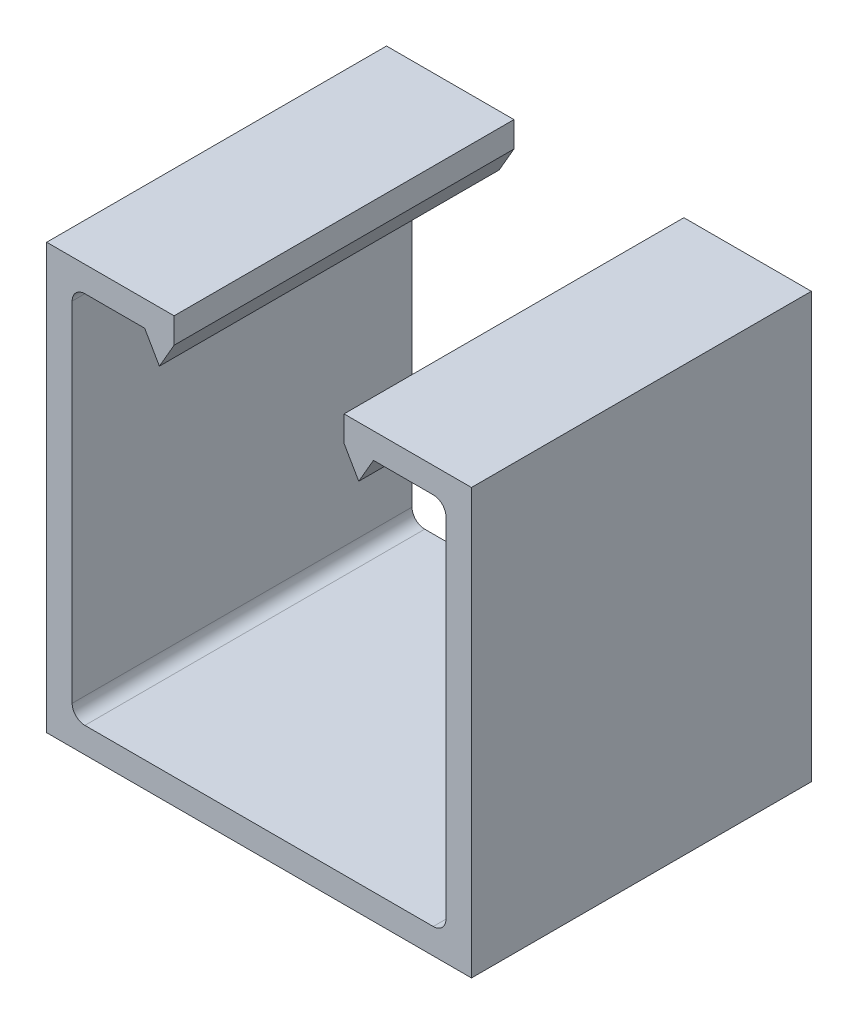
from build123d import *

# Parameters (mm, degrees)
BASE_EXTRUDE_DEPTH = 12.7


with BuildPart() as part:
    # Sketch1 → Base-Extrude (new, symmetric)
    with BuildSketch(Plane.XY):
        with BuildLine():
            Line((-6.35, 15.875), (-15.875, 15.875))
            Line((-15.875, 15.875), (-15.875, -15.875))
            Line((-15.875, -15.875), (15.875, -15.875))
            Line((15.875, -15.875), (15.875, 15.875))
            Line((15.875, 15.875), (6.35, 15.875))
            Line((6.35, 15.875), (6.35, 13.97))
            Line((6.35, 13.97), (7.449852264, 12.065))
            Line((7.449852264, 12.065), (8.549704526, 13.97))
            Line((8.549704526, 13.97), (13.0175, 13.97))
            ThreePointArc((13.0175, 13.97), (13.691019209, 13.691019209), (13.97, 13.0175))
            Line((13.97, 13.0175), (13.97, -13.0175))
            ThreePointArc((13.97, -13.0175), (13.691019209, -13.691019209), (13.0175, -13.97))
            Line((13.0175, -13.97), (-13.0175, -13.97))
            ThreePointArc((-13.0175, -13.97), (-13.691019209, -13.691019209), (-13.97, -13.0175))
            Line((-13.97, -13.0175), (-13.97, 13.0175))
            ThreePointArc((-13.97, 13.0175), (-13.691019209, 13.691019209), (-13.0175, 13.97))
            Line((-13.0175, 13.97), (-8.549704526, 13.97))
            Line((-8.549704526, 13.97), (-7.449852264, 12.065))
            Line((-7.449852264, 12.065), (-6.35, 13.97))
            Line((-6.35, 13.97), (-6.35, 15.875))
        make_face()
    extrude(amount=BASE_EXTRUDE_DEPTH, both=True)


solid = part.part
